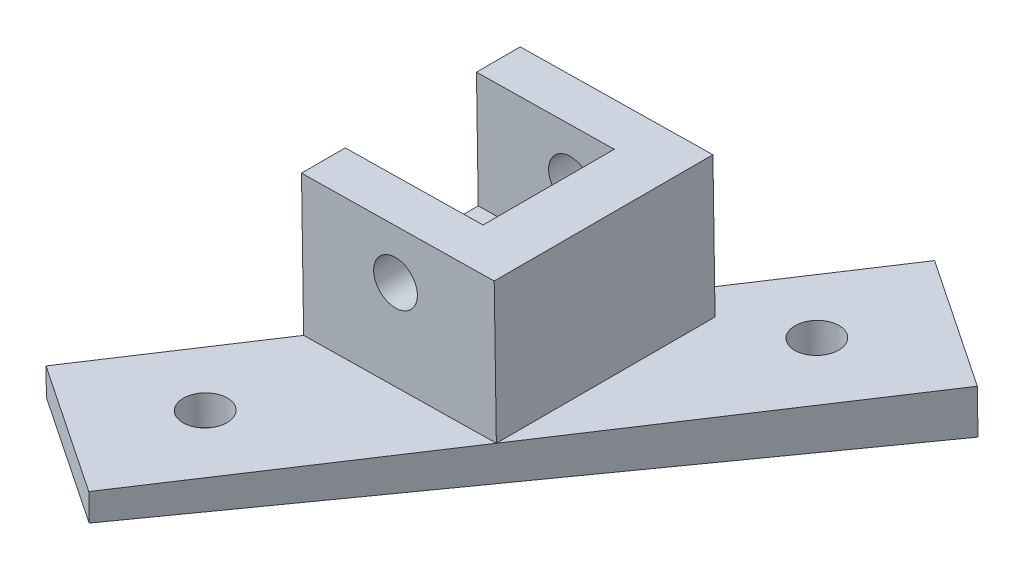
from build123d import *

# Parameters (mm, degrees)
BOSS_EXTRUDE2_DEPTH = 19.05
BOSS_EXTRUDE3_DEPTH = 6.35
BOSS_EXTRUDE4_DEPTH = 6.35
SKETCH5_R           = 3.175
CUT_EXTRUDE1_DEPTH  = 653.553447442
SKETCH6_R           = 3.175
CUT_EXTRUDE2_DEPTH  = 653.553447442
BOSS_EXTRUDE7_DEPTH = 7.874
SKETCH12_R          = 3.175
CUT_EXTRUDE4_DEPTH  = 675.468016292
BOSS_EXTRUDE8_DEPTH = 23.1648
CUT_EXTRUDE6_DEPTH  = 429.875020033


with BuildPart() as part:
    # Sketch1 → Boss-Extrude2 (new body)
    with BuildSketch(Plane.XY):
        with BuildLine():
            Line((642.224572561, 111.046838573), (634.252545404, 110.925124722))
            ThreePointArc((634.252545404, 110.925124722), (637.340775548, 101.689054702), (630.810820972, 94.46397006))
            Line((630.810820972, 94.46397006), (628.034186285, 94.421577467))
            add(Edge.make_bspline(
                [(623.884527878, 94.077084958), (624.201469176, 94.081923896), (624.52651862, 94.107859076), (625.194071811, 94.176161637), (625.538291649, 94.218971248), (626.23780183, 94.300697743), (626.591177817, 94.339281954), (627.30622807, 94.396985819), (627.667912536, 94.41598534), (628.034186285, 94.421577467)],
                knots=[0, 0, 0, 0, 0.25, 0.25, 0.5, 0.5, 0.75, 0.75, 1, 1, 1, 1], degree=3))
            Line((623.884527878, 94.077084958), (614.502973196, 93.933850981))
            Line((614.502973196, 93.933850981), (614.557258512, 90.378265361))
            Line((614.557258512, 90.378265361), (642.533611114, 90.805397577))
            Line((642.533611114, 90.805397577), (642.224572561, 111.046838573))
        make_face()
    extrude(amount=-BOSS_EXTRUDE2_DEPTH)

    # Sketch2 → Boss-Extrude3 (add)
    with BuildSketch(Plane.XY):
        Polygon((614.557258512, 90.378265361), (614.248219959, 110.619706357), (642.224572561, 111.046838573), (642.533611114, 90.805397577), align=None)
    extrude(amount=BOSS_EXTRUDE3_DEPTH)

    # Sketch4 → Boss-Extrude4 (add)
    with BuildSketch(Plane(origin=(0, 0, -19.05), x_dir=(-1, 0, 0), z_dir=(0, 0, -1))):
        Polygon((-614.557258512, 90.378265361), (-614.248219959, 110.619706357), (-642.224572561, 111.046838573), (-642.533611114, 90.805397577), align=None)
    extrude(amount=BOSS_EXTRUDE4_DEPTH)

    # Sketch5 → Cut-Extrude1 (cut, through all)
    with BuildSketch(Plane(origin=(0, 0, 0), x_dir=(-1, 0, 0), z_dir=(0, 0, -1))):
        with Locations((-627.893070479, 103.664395923)):
            Circle(SKETCH5_R)
    extrude(amount=-CUT_EXTRUDE1_DEPTH, mode=Mode.SUBTRACT)

    # Sketch6 → Cut-Extrude2 (cut, through all)
    with BuildSketch(Plane.XY.offset(-19.05)):
        with Locations(Location((627.893070479, 103.664395923, 0), (0, 0, 180))):
            Circle(SKETCH6_R)
    extrude(amount=-CUT_EXTRUDE2_DEPTH, mode=Mode.SUBTRACT)

    # Sketch11 → Boss-Extrude7 (add)
    with BuildSketch(Plane(origin=(-1.236319125, 80.976565327, 0), x_dir=(0.9998834703189056, 0.015265837121568253, 0), z_dir=(0.015265837121568255, -0.9998834703189057, 0))):
        Polygon((615.865344229, 6.35), (600.772109003, 28.658661472), (619.965955333, 41.644525188), (643.844957287, 6.35), (672.023174673, -35.299010508), (652.829328343, -48.284874224), align=None)
    extrude(amount=BOSS_EXTRUDE7_DEPTH)

    # Sketch12 → Cut-Extrude4 (cut, through all)
    with BuildSketch(Plane(origin=(-1.236319125, 80.976565327, 0), x_dir=(0.9998834703189056, 0.015265837121568083, 0), z_dir=(-0.015265837121568085, 0.9998834703189057, 0))):
        with Locations(Location((618.191262939, -22.963551046, 0), (0, 0, 180))):
            Circle(SKETCH12_R)
        with Locations(Location((654.022628802, 29.997248883, 0), (0, 0, 180))):
            Circle(SKETCH12_R)
    extrude(amount=-CUT_EXTRUDE4_DEPTH, mode=Mode.SUBTRACT)

    # Sketch13 → Boss-Extrude8 (add)
    with BuildSketch(Plane(origin=(444.569112267, 6.787510604, 300.814470562), x_dir=(0.5602970950459771, 0.008554401034284214, -0.8282475399939222), z_dir=(0.8281510245722196, 0.012643892041886809, 0.5603623938970352))):
        Polygon((312.913631323, 73.066855862), (405.705293775, 70.658703567), (405.812833532, 73.1120026), (312.913631323, 73.1120026), align=None)
    extrude(amount=-BOSS_EXTRUDE8_DEPTH)

    # Sketch14 → Cut-Extrude6 (cut, through all)
    with BuildSketch(Plane(origin=(444.569112267, 6.787510604, 300.814470562), x_dir=(0.5602970950459771, 0.008554401034284214, -0.8282475399939222), z_dir=(0.8281510245722196, 0.012643892041886809, 0.5603623938970352))):
        Polygon((312.913631323, 73.066855862), (312.913631323, 77.045511862), (405.812833532, 74.637359567), (405.705293775, 70.658703567), align=None)
    extrude(amount=-CUT_EXTRUDE6_DEPTH, mode=Mode.SUBTRACT)


with BuildPart() as body_2:
    # of the pieces the cut leaves, the one that is kept (cut_extrude6_keep)
    add(part.part.solids().sort_by_distance((634.252545404, 110.925124722, 0))[0])


solid = body_2.part
